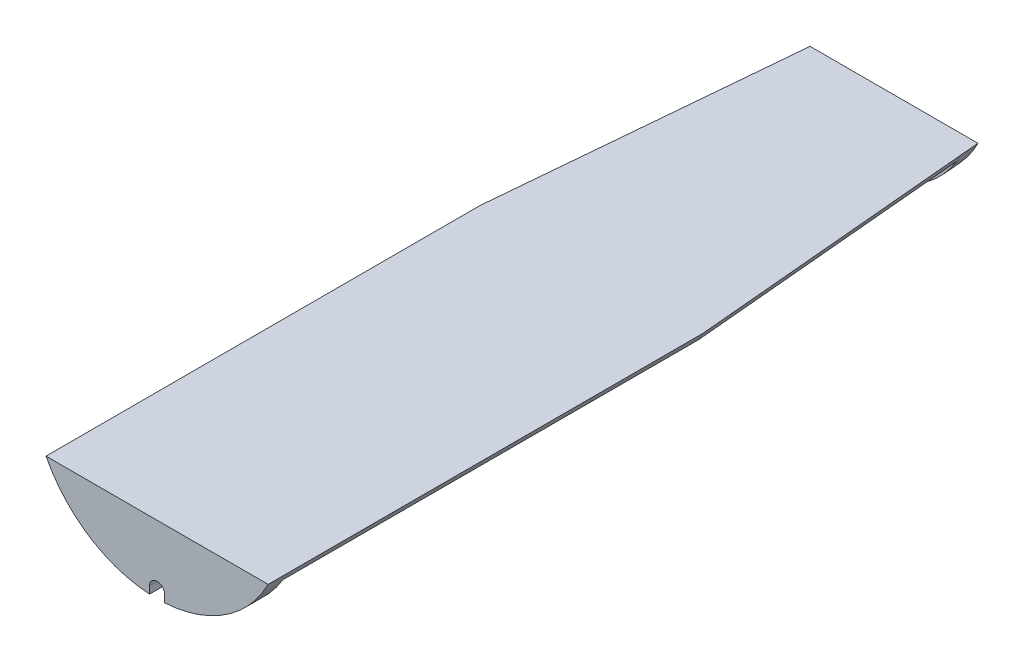
from build123d import *

# Parameters (mm, degrees)
BOSS_EXTRUDE1_DEPTH = 5
BOSS_EXTRUDE2_DEPTH = 110


with BuildPart() as part:
    # Sketch1 → Boss-Extrude1 (new body)
    with BuildSketch(Plane.XY):
        with BuildLine():
            Line((29.393876913, 0), (-29.393876913, 0))
            ThreePointArc((-29.393876913, 0), (-18.078961268, -12.607085313), (-2, -17.939338184))
            Line((-2, -17.939338184), (-2, -16))
            ThreePointArc((-2, -16), (0, -14), (2, -16))
            Line((2, -16), (2, -17.939338184))
            ThreePointArc((2, -17.939338184), (18.078961268, -12.607085313), (29.393876913, 0))
        make_face()
    extrude(amount=-BOSS_EXTRUDE1_DEPTH)

    # Sketch4 → Boss-Extrude2 (add)
    with BuildSketch(Plane(origin=(0, 0, -5), x_dir=(-1, 0, 0), z_dir=(0, 0, -1))):
        with BuildLine():
            Line((-28.284271247, -2), (28.284271247, -2))
            ThreePointArc((28.284271247, -2), (28.856406461, -1.009616054), (29.393876913, 0))
            Line((29.393876913, 0), (-29.393876913, 0))
            ThreePointArc((-29.393876913, 0), (-28.856406461, -1.009616054), (-28.284271247, -2))
        make_face()
    extrude(amount=BOSS_EXTRUDE2_DEPTH)



with BuildPart() as body_2:
    # Sketch12 → Loft4 section 0
    with BuildSketch(Plane(origin=(0, 0, -190), x_dir=(-1, 0, 0), z_dir=(0, 0, -1))):
        with BuildLine():
            Line((22.653180887, 0), (-22.653180887, 0))
            add(Edge.make_bspline(
                [(-22.653180887, 0), (-22.148977198, -1.002294604), (-21.312728642, -2.455970505), (-20.356311796, -3.834839427), (-19.691645963, -4.737243386), (-19.346258554, -5.179245011), (-17.567122979, -7.32705895), (-15.968170417, -8.864263), (-13.740314516, -10.549553496), (-13.281768803, -10.87542484), (-12.351437875, -11.495278896), (-11.878861514, -11.790005264), (-10.438884851, -12.628551852), (-9.449353735, -13.126979054), (-7.918655947, -13.779445474), (-7.400698933, -13.981090551), (-6.348352712, -14.35067626), (-5.811978486, -14.519061657), (-4.190297425, -14.964979291), (-3.100362704, -15.18241512), (-1.999999905, -15.305387205)],
                knots=[0, 0, 0, 0, 0.125, 0.1875, 0.1875, 0.25, 0.25, 0.5, 0.5, 0.5625, 0.5625, 0.625, 0.625, 0.75, 0.75, 0.8125, 0.8125, 0.875, 0.875, 1, 1, 1, 1], degree=3))
            Line((-1.999999905, -15.305387205), (-1.999999905, -13.417274226))
            add(Edge.make_bspline(
                [(2.000000095, -13.417274226), (2.000000095, -11.416233914), (9.5e-08, -11.416233914), (-1.999999905, -11.416233914), (-1.999999905, -13.417274226)],
                knots=[4.71238898, 4.71238898, 4.71238898, 6.283185307, 6.283185307, 7.853981634, 7.853981634, 7.853981634], degree=2, weights=[1, 0.707106781, 1, 0.707106781, 1]))
            Line((2.000000095, -13.417274226), (2.000000095, -15.30538728))
            add(Edge.make_bspline(
                [(2.000000095, -15.30538728), (3.11768943, -15.180478923), (4.210798102, -14.960003678), (6.358212923, -14.368193301), (7.413433781, -13.99578054), (9.48316466, -13.111567426), (10.477319809, -12.608065076), (12.391619169, -11.489443387), (13.311776359, -10.874343619), (15.080037554, -9.535479611), (15.928293309, -8.811314066), (17.550364646, -7.253254035), (18.308014434, -6.434881586), (20.428872732, -3.867681555), (21.642679013, -2.008752815), (22.653180887, 0)],
                knots=[0, 0, 0, 0, 0.125, 0.125, 0.25, 0.25, 0.375, 0.375, 0.5, 0.5, 0.625, 0.625, 0.75, 0.75, 1, 1, 1, 1], degree=3))
        make_face()
    # Sketch13 → Loft4 section 1
    with BuildSketch(Plane(origin=(0, 0, -195), x_dir=(-1, 0, 0), z_dir=(0, 0, -1))):
        with BuildLine():
            Line((22.23493812, 0), (-22.23493812, 0))
            add(Edge.make_bspline(
                [(-22.23493812, 0), (-21.740282728, -0.98514663), (-20.92074495, -2.414398694), (-19.984690863, -3.770833773), (-19.334428952, -4.658733952), (-18.995985903, -5.094588627), (-17.253288329, -7.212565885), (-15.688377335, -8.729957297), (-13.509914793, -10.396251463), (-13.061466045, -10.718755366), (-12.149963097, -11.333679684), (-11.686964176, -11.626255977), (-10.276201265, -12.459278365), (-9.306792445, -12.955267146), (-7.807228346, -13.605896686), (-7.299808046, -13.807233863), (-6.268850056, -14.176803971), (-5.743994744, -14.345317324), (-4.151377213, -14.793942329), (-3.080899423, -15.013927219), (-2.0000001, -15.139517415)],
                knots=[0, 0, 0, 0, 0.125, 0.1875, 0.1875, 0.25, 0.25, 0.5, 0.5, 0.5625, 0.5625, 0.625, 0.625, 0.75, 0.75, 0.8125, 0.8125, 0.875, 0.875, 1, 1, 1, 1], degree=3))
            Line((-2.0000001, -15.139517415), (-2.0000001, -13.255983903))
            add(Edge.make_bspline(
                [(1.9999999, -13.255983903), (1.9999999, -11.254943591), (-1e-07, -11.254943591), (-2.0000001, -11.254943591), (-2.0000001, -13.255983903)],
                knots=[1.570796327, 1.570796327, 1.570796327, 3.141592654, 3.141592654, 4.71238898, 4.71238898, 4.71238898], degree=2, weights=[1, 0.707106781, 1, 0.707106781, 1]))
            Line((1.9999999, -13.255983903), (1.9999999, -15.139517335))
            add(Edge.make_bspline(
                [(1.9999999, -15.139517335), (3.097475762, -15.012001028), (4.170492913, -14.789132022), (5.751323617, -14.342960473), (6.273417873, -14.175331497), (7.308353862, -13.804002428), (7.822701798, -13.599731703), (9.341618745, -12.939021482), (10.314473073, -12.438519778), (12.187983442, -11.328505685), (13.088646639, -10.719004096), (14.819688416, -9.393879642), (15.651226146, -8.676872801), (17.2374738, -7.139809792), (17.978680245, -6.333075632), (20.054337825, -3.803997633), (21.243421171, -1.974687006), (22.23493812, 0)],
                knots=[0, 0, 0, 0, 0.125, 0.125, 0.1875, 0.1875, 0.25, 0.25, 0.375, 0.375, 0.5, 0.5, 0.625, 0.625, 0.75, 0.75, 1, 1, 1, 1], degree=3))
        make_face()
    loft()


with BuildPart() as part_1:
    add(part.part)

    add(body_2.part)  # Loft5 merges body 2
    # Sketch15 for Loft5 → Loft5 section 0
    with BuildSketch(Plane(origin=(0, 0, -115), x_dir=(-1, 0, 0), z_dir=(0, 0, -1))):
        with BuildLine():
            Line((-28.284271247, -2), (28.284271247, -2))
            # circular arc as an exact rational Bezier (weights 1, cos(half-angle), 1)
            Bezier((28.284271247, -2), (28.873749257, -1.019237886), (29.393876913, 0), weights=[1, 0.999399358, 1])
            Line((29.393876913, 0), (-29.393876913, 0))
            Bezier((-29.393876913, 0), (-28.873749257, -1.019237886), (-28.284271247, -2), weights=[1, 0.999399358, 1])
        make_face()
    # Sketch14 → Loft5 section 1
    with BuildSketch(Plane.XY.offset(-190)):
        with BuildLine():
            Line((-21.55031948, -2), (21.549816234, -2))
            add(Edge.make_bspline(
                [(21.549816234, -2), (21.942306372, -1.348710735), (22.310082744, -0.682036694), (22.653180887, 0)],
                knots=[0.914940591, 0.914940591, 0.914940591, 0.914940591, 1, 1, 1, 1], degree=3))
            Line((22.653180887, 0), (-22.653180887, 0))
            add(Edge.make_bspline(
                [(-22.653180887, 0), (-22.309091279, -0.684007607), (-21.941428628, -1.350643187), (-21.55031948, -2)],
                knots=[0, 0, 0, 0, 0.085128394, 0.085128394, 0.085128394, 0.085128394], degree=3))
        make_face()
    loft()


solid = part_1.part
